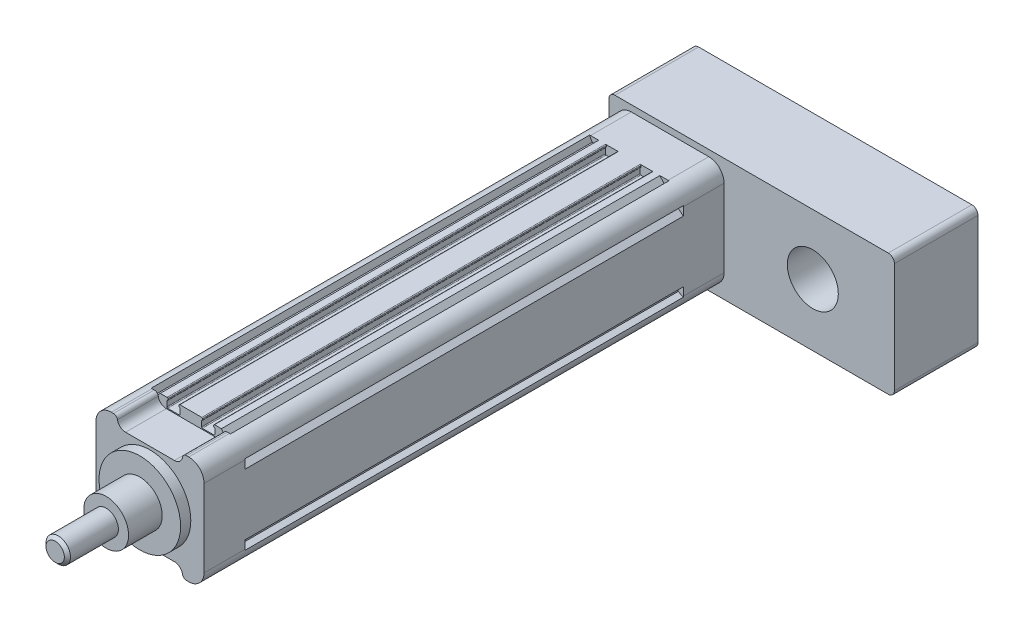
from build123d import *

# Parameters (mm, degrees)
SKETCH_1_R                  = 2.1
EXTRUDE_1_DEPTH             = 215
EXTRUDE_2_DEPTH             = 20
SKETCH_7_R                  = 20
EXTRUDE_3_DEPTH             = 5
SKETCH_9_R                  = 11
EXTRUDE_4_DEPTH             = 16.5
SKETCH_10_R                 = 6
EXTRUDE_5_DEPTH             = 25
EXTRUDE_START               = 20
EXTRUDE_6_DEPTH             = 20
EXTRUDE_7_DEPTH             = 41
SKETCH_13_R                 = 12.5
CUT_EXTRUDE_2_DEPTH         = 30
PATTERN_LINEAR_1_COUNT      = 2
PATTERN_LINEAR_1_PITCH      = 38
PATTERN_LINEAR_1_COUNT_DIR2 = 2
PATTERN_LINEAR_1_PITCH_DIR2 = 38
HOLE_WIZARD_M6_2_D          = 5
HOLE_WIZARD_M6_2_DEPTH      = 15
HOLE_WIZARD_M6_2_TIP        = 1.502151548
HOLE_WIZARD_M6_3_D          = 5
HOLE_WIZARD_M6_3_DEPTH      = 15
HOLE_WIZARD_M6_3_TIP        = 1.502151548
HOLE_WIZARD_M6_4_D          = 5
HOLE_WIZARD_M6_4_DEPTH      = 15
HOLE_WIZARD_M6_4_TIP        = 1.502151548
CHAMFER_1_SIZE              = 1.5


with BuildPart() as part:
    # 草图1 → 凸台-拉伸1 (new body)
    with BuildSketch(Plane.XY):
        with BuildLine():
            Line((-18.2, 24), (-19.443439638, 26.486879276))
            ThreePointArc((-19.443439638, 26.486879276), (-24.303300859, 24.303300859), (-26.486879276, 19.443439638))
            Line((-26.486879276, 19.443439638), (-24, 18.2))
            Line((-24, 18.2), (-24, 17.1))
            Line((-24, 17.1), (-26.5, 15))
            Line((-26.5, 15), (-26.5, -15))
            Line((-26.5, -15), (-24, -17.1))
            Line((-24, -17.1), (-24, -18.2))
            Line((-24, -18.2), (-26.486879276, -19.443439638))
            ThreePointArc((-26.486879276, -19.443439638), (-24.303300859, -24.303300859), (-19.443439638, -26.486879276))
            Line((-19.443439638, -26.486879276), (-18.2, -24))
            Line((-18.2, -24), (-17.1, -24))
            Line((-17.1, -24), (-15, -26.5))
            Line((-15, -26.5), (-11.65, -26.5))
            ThreePointArc((-11.65, -26.5), (-11.367157288, -26.382842712), (-11.25, -26.1))
            Line((-11.25, -26.1), (-11.25, -25.6))
            ThreePointArc((-11.25, -25.6), (-11.367157288, -25.317157288), (-11.65, -25.2))
            Line((-11.65, -25.2), (-11.75, -25.2))
            Line((-11.75, -25.2), (-11.75, -22.4))
            ThreePointArc((-11.75, -22.4), (-11.632842712, -22.117157288), (-11.35, -22))
            Line((-11.35, -22), (-5.65, -22))
            ThreePointArc((-5.65, -22), (-5.367157288, -22.117157288), (-5.25, -22.4))
            Line((-5.25, -22.4), (-5.25, -25.2))
            Line((-5.25, -25.2), (-5.35, -25.2))
            ThreePointArc((-5.35, -25.2), (-5.632842712, -25.317157288), (-5.75, -25.6))
            Line((-5.75, -25.6), (-5.75, -26.1))
            ThreePointArc((-5.75, -26.1), (-5.632842712, -26.382842712), (-5.35, -26.5))
            Line((-5.35, -26.5), (5.35, -26.5))
            ThreePointArc((5.35, -26.5), (5.632842712, -26.382842712), (5.75, -26.1))
            Line((5.75, -26.1), (5.75, -25.6))
            ThreePointArc((5.75, -25.6), (5.632842712, -25.317157288), (5.35, -25.2))
            Line((5.35, -25.2), (5.25, -25.2))
            Line((5.25, -25.2), (5.25, -22.4))
            ThreePointArc((5.25, -22.4), (5.367157288, -22.117157288), (5.65, -22))
            Line((5.65, -22), (11.35, -22))
            ThreePointArc((11.35, -22), (11.632842712, -22.117157288), (11.75, -22.4))
            Line((11.75, -22.4), (11.75, -25.2))
            Line((11.75, -25.2), (11.65, -25.2))
            ThreePointArc((11.65, -25.2), (11.367157288, -25.317157288), (11.25, -25.6))
            Line((11.25, -25.6), (11.25, -26.1))
            ThreePointArc((11.25, -26.1), (11.367157288, -26.382842712), (11.65, -26.5))
            Line((11.65, -26.5), (15, -26.5))
            Line((15, -26.5), (17.1, -24))
            Line((17.1, -24), (18.2, -24))
            Line((18.2, -24), (19.443439638, -26.486879276))
            ThreePointArc((19.443439638, -26.486879276), (24.303300859, -24.303300859), (26.486879276, -19.443439638))
            Line((26.486879276, -19.443439638), (24, -18.2))
            Line((24, -18.2), (24, -17.1))
            Line((24, -17.1), (26.5, -15))
            Line((26.5, -15), (26.5, 15))
            Line((26.5, 15), (24, 17.1))
            Line((24, 17.1), (24, 18.2))
            Line((24, 18.2), (26.486879276, 19.443439638))
            ThreePointArc((26.486879276, 19.443439638), (24.303300859, 24.303300859), (19.443439638, 26.486879276))
            Line((19.443439638, 26.486879276), (18.2, 24))
            Line((18.2, 24), (17.1, 24))
            Line((17.1, 24), (15, 26.5))
            Line((15, 26.5), (11.65, 26.5))
            ThreePointArc((11.65, 26.5), (11.367157288, 26.382842712), (11.25, 26.1))
            Line((11.25, 26.1), (11.25, 25.6))
            ThreePointArc((11.25, 25.6), (11.367157288, 25.317157288), (11.65, 25.2))
            Line((11.65, 25.2), (11.75, 25.2))
            Line((11.75, 25.2), (11.75, 22.4))
            ThreePointArc((11.75, 22.4), (11.632842712, 22.117157288), (11.35, 22))
            Line((11.35, 22), (5.65, 22))
            ThreePointArc((5.65, 22), (5.367157288, 22.117157288), (5.25, 22.4))
            Line((5.25, 22.4), (5.25, 25.2))
            Line((5.25, 25.2), (5.35, 25.2))
            ThreePointArc((5.35, 25.2), (5.632842712, 25.317157288), (5.75, 25.6))
            Line((5.75, 25.6), (5.75, 26.1))
            ThreePointArc((5.75, 26.1), (5.632842712, 26.382842712), (5.35, 26.5))
            Line((5.35, 26.5), (-5.35, 26.5))
            ThreePointArc((-5.35, 26.5), (-5.632842712, 26.382842712), (-5.75, 26.1))
            Line((-5.75, 26.1), (-5.75, 25.6))
            ThreePointArc((-5.75, 25.6), (-5.632842712, 25.317157288), (-5.35, 25.2))
            Line((-5.35, 25.2), (-5.25, 25.2))
            Line((-5.25, 25.2), (-5.25, 22.4))
            ThreePointArc((-5.25, 22.4), (-5.367157288, 22.117157288), (-5.65, 22))
            Line((-5.65, 22), (-11.35, 22))
            ThreePointArc((-11.35, 22), (-11.632842712, 22.117157288), (-11.75, 22.4))
            Line((-11.75, 22.4), (-11.75, 25.2))
            Line((-11.75, 25.2), (-11.65, 25.2))
            ThreePointArc((-11.65, 25.2), (-11.367157288, 25.317157288), (-11.25, 25.6))
            Line((-11.25, 25.6), (-11.25, 26.1))
            ThreePointArc((-11.25, 26.1), (-11.367157288, 26.382842712), (-11.65, 26.5))
            Line((-11.65, 26.5), (-15, 26.5))
            Line((-15, 26.5), (-17.1, 24))
            Line((-17.1, 24), (-18.2, 24))
        make_face()
        with Locations((19, 19)):
            Circle(SKETCH_1_R, mode=Mode.SUBTRACT)
        with Locations((19, -19)):
            Circle(SKETCH_1_R, mode=Mode.SUBTRACT)
        with Locations((-19, -19)):
            Circle(SKETCH_1_R, mode=Mode.SUBTRACT)
        with Locations((-19, 19)):
            Circle(SKETCH_1_R, mode=Mode.SUBTRACT)
        with BuildLine():
            Line((19.773719933, 3), (23.3, 3))
            Line((23.3, 3), (23.3, -3))
            Line((23.3, -3), (19.773719933, -3))
            ThreePointArc((19.773719933, -3), (0, -20), (-19.773719933, -3))
            Line((-19.773719933, -3), (-23.3, -3))
            Line((-23.3, -3), (-23.3, 3))
            Line((-23.3, 3), (-19.773719933, 3))
            ThreePointArc((-19.773719933, 3), (0, 20), (19.773719933, 3))
        make_face(mode=Mode.SUBTRACT)
    extrude(amount=EXTRUDE_1_DEPTH)

    # 草图6 → 凸台-拉伸2 (add)
    with BuildSketch(Plane.XY.offset(215)):
        with BuildLine():
            Line((-26.5, -19), (-26.5, 19))
            ThreePointArc((-26.5, 19), (-24.303300859, 24.303300859), (-19, 26.5))
            Line((-19, 26.5), (-17.916079783, 26.5))
            ThreePointArc((-17.916079783, 26.5), (-16.625085334, 26.027525232), (-15.944053189, 24.833333333))
            ThreePointArc((-15.944053189, 24.833333333), (-14.581988897, 22.444949537), (-12, 21.5))
            Line((-12, 21.5), (12, 21.5))
            ThreePointArc((12, 21.5), (14.581988897, 22.444949537), (15.944053189, 24.833333333))
            ThreePointArc((15.944053189, 24.833333333), (16.625085334, 26.027525232), (17.916079783, 26.5))
            Line((17.916079783, 26.5), (19, 26.5))
            ThreePointArc((19, 26.5), (24.303300859, 24.303300859), (26.5, 19))
            Line((26.5, 19), (26.5, -19))
            ThreePointArc((26.5, -19), (24.303300859, -24.303300859), (19, -26.5))
            Line((19, -26.5), (17.916079783, -26.5))
            ThreePointArc((17.916079783, -26.5), (16.625085334, -26.027525232), (15.944053189, -24.833333333))
            ThreePointArc((15.944053189, -24.833333333), (14.581988897, -22.444949537), (12, -21.5))
            Line((12, -21.5), (-12, -21.5))
            ThreePointArc((-12, -21.5), (-14.581988897, -22.444949537), (-15.944053189, -24.833333333))
            ThreePointArc((-15.944053189, -24.833333333), (-16.625085334, -26.027525232), (-17.916079783, -26.5))
            Line((-17.916079783, -26.5), (-19, -26.5))
            ThreePointArc((-19, -26.5), (-24.303300859, -24.303300859), (-26.5, -19))
        make_face()
    extrude(amount=EXTRUDE_2_DEPTH)

    # 草图7 → 凸台-拉伸3 (add)
    with BuildSketch(Plane.XY.offset(235)):
        Circle(SKETCH_7_R)
    extrude(amount=EXTRUDE_3_DEPTH)

    # 草图9 → 凸台-拉伸4 (add)
    with BuildSketch(Plane.XY.offset(240)):
        Circle(SKETCH_9_R)
    extrude(amount=EXTRUDE_4_DEPTH)

    # 草图10 → 凸台-拉伸5 (add)
    with BuildSketch(Plane.XY.offset(256.5)):
        Circle(SKETCH_10_R)
    extrude(amount=EXTRUDE_5_DEPTH)

    # 草图11 → 凸台-拉伸6 (add)
    with BuildSketch(Plane(origin=(0, 0, 0), x_dir=(-1, 0, 0), z_dir=(0, 0, -1)).offset(EXTRUDE_START)):
        with BuildLine():
            Line((-19, -26.5), (19, -26.5))
            ThreePointArc((19, -26.5), (24.303300859, -24.303300859), (26.5, -19))
            Line((26.5, -19), (26.5, 19))
            ThreePointArc((26.5, 19), (24.303300859, 24.303300859), (19, 26.5))
            Line((19, 26.5), (-19, 26.5))
            ThreePointArc((-19, 26.5), (-24.303300859, 24.303300859), (-26.5, 19))
            Line((-26.5, 19), (-26.5, -19))
            ThreePointArc((-26.5, -19), (-24.303300859, -24.303300859), (-19, -26.5))
        make_face()
    extrude(amount=-EXTRUDE_6_DEPTH)

    # 草图12 → 凸台-拉伸7 (add)
    with BuildSketch(Plane(origin=(0, 0, -20), x_dir=(-1, 0, 0), z_dir=(0, 0, -1))):
        with BuildLine():
            Line((-107, -30.404162038), (27, -30.404162038))
            ThreePointArc((27, -30.404162038), (29.121320344, -29.525482382), (30, -27.404162038))
            Line((30, -27.404162038), (30, 26.595837962))
            ThreePointArc((30, 26.595837962), (29.121320344, 28.717158305), (27, 29.595837962))
            Line((27, 29.595837962), (-107, 29.595837962))
            ThreePointArc((-107, 29.595837962), (-109.121320344, 28.717158305), (-110, 26.595837962))
            Line((-110, 26.595837962), (-110, -27.404162038))
            ThreePointArc((-110, -27.404162038), (-109.121320344, -29.525482382), (-107, -30.404162038))
        make_face()
    extrude(amount=EXTRUDE_7_DEPTH)

    # 草图13 → 切除-拉伸2 (cut)
    with BuildSketch(Plane.XY.offset(-20)):
        with Locations((70, 0)):
            Circle(SKETCH_13_R)
    extrude(amount=-CUT_EXTRUDE_2_DEPTH, mode=Mode.SUBTRACT)

    # 草图15 → M6 螺纹孔1 (revolve, cut)
    with BuildSketch(Plane(origin=(-19, -19, -61), x_dir=(0, 1, 0), z_dir=(1, 0, 0))):
        Polygon((0, 0), (0, 16.502151548), (2.5, 15), (2.5, 0), align=None)
    hole_wizard_m6_1 = revolve(axis=Axis((-19, -19, -67.35), (0, 0, 1)), mode=Mode.SUBTRACT)

    # 阵列(线性)1: Hole Wizard M6 _1 2 × 2
    with Locations(*[(j * PATTERN_LINEAR_1_PITCH_DIR2, i * PATTERN_LINEAR_1_PITCH, 0) for i in range(PATTERN_LINEAR_1_COUNT) for j in range(PATTERN_LINEAR_1_COUNT_DIR2) if (i, j) != (0, 0)]):
        add(hole_wizard_m6_1, mode=Mode.SUBTRACT)

    # M6 螺纹孔2
    with Locations(Plane(origin=(0, 0, -61), x_dir=(-1, 0, 0), z_dir=(0, 0, -1))):
        with Locations((-84, -19), (-84, 19)):
            Hole(HOLE_WIZARD_M6_2_D / 2, depth=HOLE_WIZARD_M6_2_DEPTH)
            with Locations((0, 0, -(HOLE_WIZARD_M6_2_DEPTH + HOLE_WIZARD_M6_2_TIP / 2))):  # 118° drill point
                Cone(0, HOLE_WIZARD_M6_2_D / 2, HOLE_WIZARD_M6_2_TIP, mode=Mode.SUBTRACT)

    # M6 螺纹孔3
    with Locations(Plane.ZY.offset(26.5)):
        with Locations((225, 11), (225, -11)):
            Hole(HOLE_WIZARD_M6_3_D / 2, depth=HOLE_WIZARD_M6_3_DEPTH)
            with Locations((0, 0, -(HOLE_WIZARD_M6_3_DEPTH + HOLE_WIZARD_M6_3_TIP / 2))):  # 118° drill point
                Cone(0, HOLE_WIZARD_M6_3_D / 2, HOLE_WIZARD_M6_3_TIP, mode=Mode.SUBTRACT)

    # M6 螺纹孔4
    with Locations(Plane.ZY.offset(26.5)):
        with Locations((-10, 11), (-10, -11)):
            Hole(HOLE_WIZARD_M6_4_D / 2, depth=HOLE_WIZARD_M6_4_DEPTH)
            with Locations((0, 0, -(HOLE_WIZARD_M6_4_DEPTH + HOLE_WIZARD_M6_4_TIP / 2))):  # 118° drill point
                Cone(0, HOLE_WIZARD_M6_4_D / 2, HOLE_WIZARD_M6_4_TIP, mode=Mode.SUBTRACT)

    # 倒角1
    chamfer_1_edges = [part.edges().sort_by_distance(p)[0] for p in [
        (-6, 0, 281.5),
    ]]
    chamfer(chamfer_1_edges, length=CHAMFER_1_SIZE)


solid = part.part
